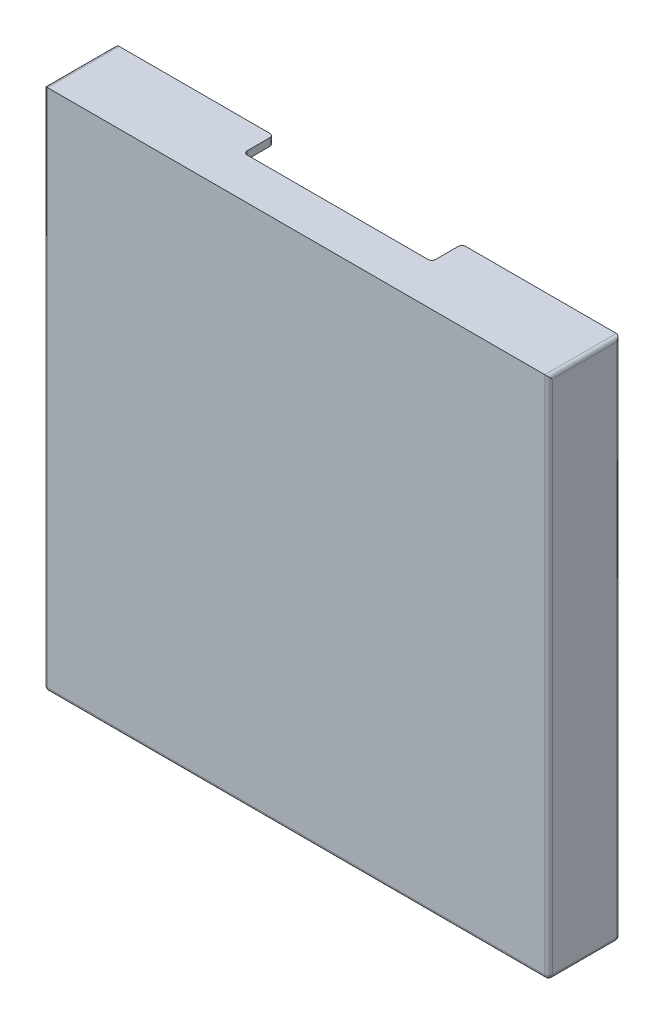
from build123d import *

# Parameters (mm, degrees)
SKETCH_1_W          = 268
SKETCH_1_H          = 38
EXTRUDE_1_DEPTH     = 278
SKETCH_2_W          = 260
SKETCH_2_H          = 270
CUT_EXTRUDE_1_DEPTH = 36
CUT_EXTRUDE_2_REACH = 311.194
SKETCH_3_W          = 100
SKETCH_3_H          = 16
FILLET_1_R          = 2


with BuildPart() as part:
    # 草图1 → 凸台-拉伸1 (new body)
    with BuildSketch(Plane(origin=(0, 0, 0), x_dir=(1, 0, 0), z_dir=(0, 1, 0))):
        Rectangle(SKETCH_1_W, SKETCH_1_H)
    extrude(amount=EXTRUDE_1_DEPTH)

    # 草图2 → 切除-拉伸1 (cut)
    with BuildSketch(Plane(origin=(0, 0, -19), x_dir=(-1, 0, 0), z_dir=(0, 0, -1))):
        with Locations((0, 139)):
            Rectangle(SKETCH_2_W, SKETCH_2_H)
    extrude(amount=-CUT_EXTRUDE_1_DEPTH, mode=Mode.SUBTRACT)

    # 草图3 → 切除-拉伸2 (cut, up to next)
    with BuildSketch(Plane(origin=(0, 278, 0), x_dir=(1, 0, 0), z_dir=(0, 1, 0)), mode=Mode.PRIVATE) as cut_extrude_2_sk1:
        with Locations((0, 11)):
            Rectangle(SKETCH_3_W, SKETCH_3_H)
    cut_extrude_2_tool1 = extrude(cut_extrude_2_sk1.sketch, amount=-CUT_EXTRUDE_2_REACH, mode=Mode.PRIVATE) & part.part
    add(cut_extrude_2_tool1.solids().sort_by_distance((0, 278, -11))[0], mode=Mode.SUBTRACT)

    # 圆角1
    fillet_1_edges = [part.edges().sort_by_distance(p)[0] for p in [
        (134, 278, 0),
        (-50, 276, -3),
        (-50, 276, -19),
        (50, 276, -19),
        (50, 276, -3),
        (-134, 278, 0),
        (0, 0, -19),
        (134, 0, 0),
        (0, 0, 19),
        (-134, 0, 0),
        (-134, 139, -19),
        (134, 139, -19),
        (134, 139, 19),
        (-134, 139, 19),
    ]]
    fillet(fillet_1_edges, radius=FILLET_1_R)


solid = part.part
